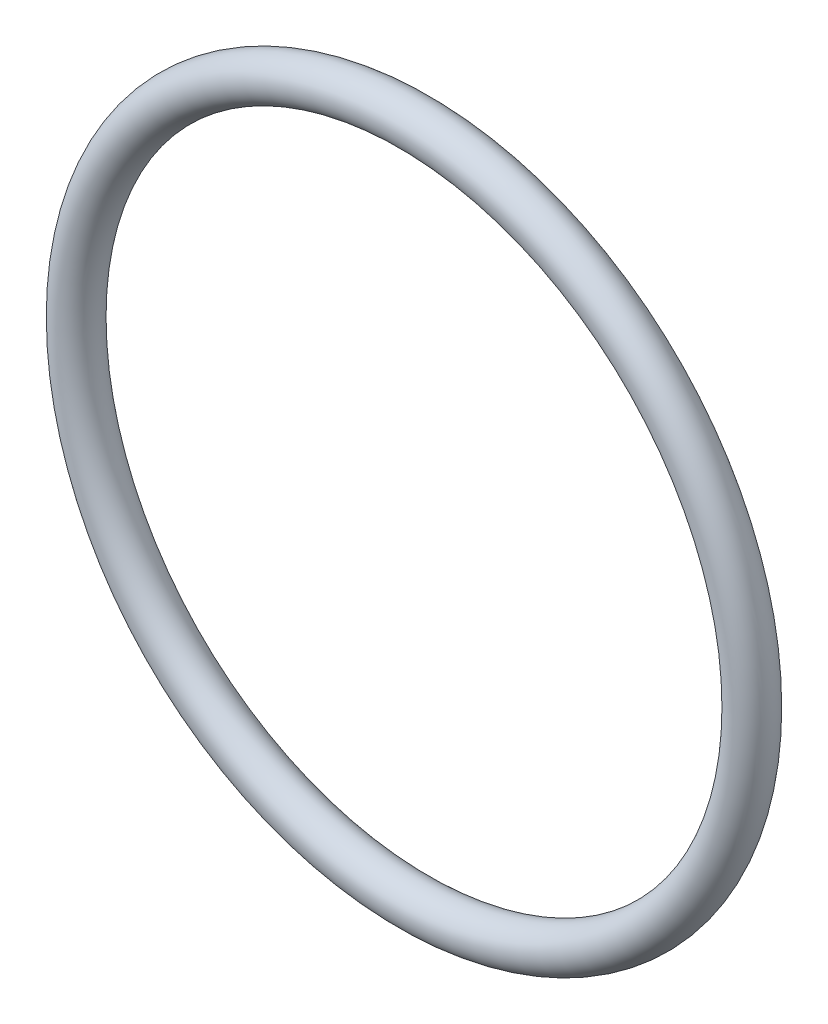
from build123d import *

# Parameters (mm, degrees)
SKETCH4_R = 1.190625


with BuildPart() as part:
    # Sweep2: sweep along a path in Sketch3
    with BuildLine(Plane.XY) as sweep2_path:
        CenterArc((0, 0), 19.022052773, 0, 360)
    # Sketch4 → Sweep2 (sweep)
    with BuildSketch(Plane(origin=(0, 0, 0), x_dir=(0, 0, -1), z_dir=(1, 0, 0))):
        with Locations((0, 19.022052773)):
            Circle(SKETCH4_R)
    sweep(path=sweep2_path.line)


solid = part.part
